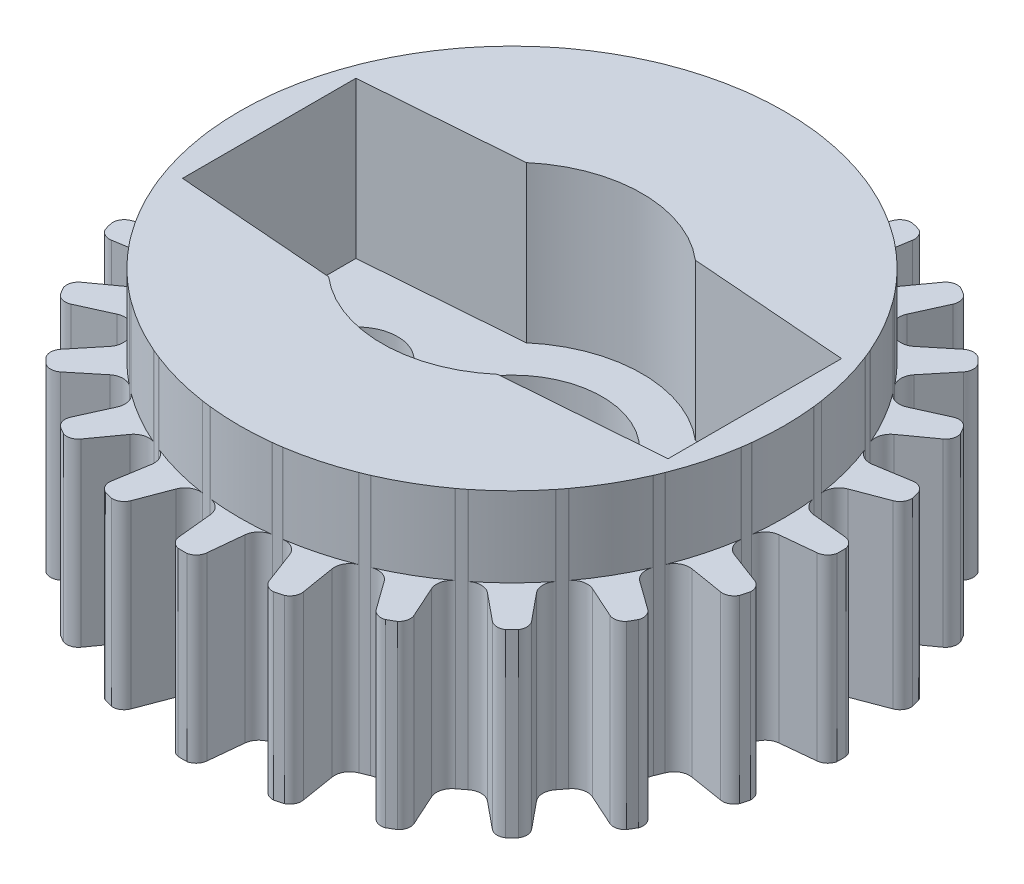
from build123d import *

# Parameters (mm, degrees)
SKETCH1_R           = 9.5
SKETCH1_R_2         = 2.6
BOSS_EXTRUDE1_DEPTH = 7.5
CUT_EXTRUDE1_START  = -7.5
SKETCH2_R           = 11.178148921
CUT_EXTRUDE1_DEPTH  = 7.5
BOSS_EXTRUDE2_START = -3.25
SKETCH3_R           = 2.6
SKETCH3_R_2         = 0.875
BOSS_EXTRUDE2_DEPTH = 3.25
CUT_EXTRUDE2_DEPTH  = 4.5
CUT_EXTRUDE3_REACH  = 16.169
SKETCH5_R           = 1.15
CUT_EXTRUDE4_START  = -2.3
SKETCH6_R           = 10.680264015
SKETCH6_R_2         = 7.851751397
CUT_EXTRUDE4_DEPTH  = 2.3


with BuildPart() as part:
    # Sketch1 → Boss-Extrude1 (new body)
    with BuildSketch(Plane(origin=(0, 0, 0), x_dir=(1, 0, 0), z_dir=(0, 1, 0))):
        with Locations(Location((0, 0, 0), (0, 0, 270))):
            Circle(SKETCH1_R)
        with Locations(Location((0, 0, 0), (0, 0, 270))):
            Circle(SKETCH1_R_2, mode=Mode.SUBTRACT)
    extrude(amount=BOSS_EXTRUDE1_DEPTH)

    # Sketch2 → Cut-Extrude1 (cut)
    with BuildSketch(Plane(origin=(0, 7.5, 0), x_dir=(1, 0, 0), z_dir=(0, 1, 0)).offset(CUT_EXTRUDE1_START)):
        Circle(SKETCH2_R)
        with BuildLine():
            Line((0.5, 8.2), (0.4, 9.2))
            ThreePointArc((0.4, 9.2), (0.265875857, 9.437834476), (0, 9.5))
            ThreePointArc((0, 9.5), (-0.265875857, 9.437834476), (-0.4, 9.2))
            Line((-0.4, 9.2), (-0.5, 8.2))
            ThreePointArc((-0.5, 8.2), (-0.628607324, 7.928607324), (-0.9, 7.8))
            ThreePointArc((-0.9, 7.8), (-1.024859212, 7.784578575), (-1.149455308, 7.767158586))
            ThreePointArc((-1.149455308, 7.767158586), (-1.444886527, 7.821142129), (-1.639353257, 8.050001298))
            Line((-1.639353257, 8.050001298), (-1.994764884, 8.99004522))
            ThreePointArc((-1.994764884, 8.99004522), (-2.18587495, 9.1850618), (-2.458780928, 9.17629535))
            ThreePointArc((-2.458780928, 9.17629535), (-2.699507664, 9.047434329), (-2.767505545, 8.782989984))
            Line((-2.767505545, 8.782989984), (-2.605279083, 7.791182253))
            ThreePointArc((-2.605279083, 7.791182253), (-2.659262626, 7.495751034), (-2.888121795, 7.301284304))
            ThreePointArc((-2.888121795, 7.301284304), (-3.004735175, 7.25407241), (-3.120577137, 7.20499815))
            ThreePointArc((-3.120577137, 7.20499815), (-3.41991375, 7.180679022), (-3.666987298, 7.351408311))
            Line((-3.666987298, 7.351408311), (-4.253589838, 8.167433715))
            ThreePointArc((-4.253589838, 8.167433715), (-4.488661992, 8.306342342), (-4.75, 8.227241336))
            ThreePointArc((-4.75, 8.227241336), (-4.949172485, 8.040466485), (-4.946410162, 7.767433715))
            Line((-4.946410162, 7.767433715), (-4.533012702, 6.851408311))
            ThreePointArc((-4.533012702, 6.851408311), (-4.508693574, 6.552071697), (-4.679422863, 6.30499815))
            ThreePointArc((-4.679422863, 6.30499815), (-4.779843401, 6.229213198), (-4.87903679, 6.151828996))
            ThreePointArc((-4.87903679, 6.151828996), (-5.161879503, 6.050864506), (-5.444722215, 6.151828996))
            Line((-5.444722215, 6.151828996), (-6.222539674, 6.788225099))
            ThreePointArc((-6.222539674, 6.788225099), (-6.485554136, 6.861559379), (-6.717514421, 6.717514421))
            ThreePointArc((-6.717514421, 6.717514421), (-6.861559379, 6.485554136), (-6.788225099, 6.222539674))
            Line((-6.788225099, 6.222539674), (-6.151828996, 5.444722215))
            ThreePointArc((-6.151828996, 5.444722215), (-6.050864506, 5.161879503), (-6.151828996, 4.87903679))
            ThreePointArc((-6.151828996, 4.87903679), (-6.229213198, 4.779843401), (-6.30499815, 4.679422863))
            ThreePointArc((-6.30499815, 4.679422863), (-6.552071697, 4.508693574), (-6.851408311, 4.533012702))
            Line((-6.851408311, 4.533012702), (-7.767433715, 4.946410162))
            ThreePointArc((-7.767433715, 4.946410162), (-8.040466485, 4.949172485), (-8.227241336, 4.75))
            ThreePointArc((-8.227241336, 4.75), (-8.306342342, 4.488661992), (-8.167433715, 4.253589838))
            Line((-8.167433715, 4.253589838), (-7.351408311, 3.666987298))
            ThreePointArc((-7.351408311, 3.666987298), (-7.180679022, 3.41991375), (-7.20499815, 3.120577137))
            ThreePointArc((-7.20499815, 3.120577137), (-7.25407241, 3.004735175), (-7.301284304, 2.888121795))
            ThreePointArc((-7.301284304, 2.888121795), (-7.495751034, 2.659262626), (-7.791182253, 2.605279083))
            Line((-7.791182253, 2.605279083), (-8.782989984, 2.767505545))
            ThreePointArc((-8.782989984, 2.767505545), (-9.047434329, 2.699507664), (-9.17629535, 2.458780928))
            ThreePointArc((-9.17629535, 2.458780928), (-9.1850618, 2.18587495), (-8.99004522, 1.994764884))
            Line((-8.99004522, 1.994764884), (-8.050001298, 1.639353257))
            ThreePointArc((-8.050001298, 1.639353257), (-7.821142129, 1.444886527), (-7.767158586, 1.149455308))
            ThreePointArc((-7.767158586, 1.149455308), (-7.784578575, 1.024859212), (-7.8, 0.9))
            ThreePointArc((-7.8, 0.9), (-7.928607324, 0.628607324), (-8.2, 0.5))
            Line((-8.2, 0.5), (-9.2, 0.4))
            ThreePointArc((-9.2, 0.4), (-9.437834476, 0.265875857), (-9.5, 0))
            ThreePointArc((-9.5, 0), (-9.437834476, -0.265875857), (-9.2, -0.4))
            Line((-9.2, -0.4), (-8.2, -0.5))
            ThreePointArc((-8.2, -0.5), (-7.928607324, -0.628607324), (-7.8, -0.9))
            ThreePointArc((-7.8, -0.9), (-7.784578575, -1.024859212), (-7.767158586, -1.149455308))
            ThreePointArc((-7.767158586, -1.149455308), (-7.821142129, -1.444886527), (-8.050001298, -1.639353257))
            Line((-8.050001298, -1.639353257), (-8.99004522, -1.994764884))
            ThreePointArc((-8.99004522, -1.994764884), (-9.1850618, -2.18587495), (-9.17629535, -2.458780928))
            ThreePointArc((-9.17629535, -2.458780928), (-9.047434329, -2.699507664), (-8.782989984, -2.767505545))
            Line((-8.782989984, -2.767505545), (-7.791182253, -2.605279083))
            ThreePointArc((-7.791182253, -2.605279083), (-7.495751034, -2.659262626), (-7.301284304, -2.888121795))
            ThreePointArc((-7.301284304, -2.888121795), (-7.25407241, -3.004735175), (-7.20499815, -3.120577137))
            ThreePointArc((-7.20499815, -3.120577137), (-7.180679022, -3.41991375), (-7.351408311, -3.666987298))
            Line((-7.351408311, -3.666987298), (-8.167433715, -4.253589838))
            ThreePointArc((-8.167433715, -4.253589838), (-8.306342342, -4.488661992), (-8.227241336, -4.75))
            ThreePointArc((-8.227241336, -4.75), (-8.040466485, -4.949172485), (-7.767433715, -4.946410162))
            Line((-7.767433715, -4.946410162), (-6.851408311, -4.533012702))
            ThreePointArc((-6.851408311, -4.533012702), (-6.552071697, -4.508693574), (-6.30499815, -4.679422863))
            ThreePointArc((-6.30499815, -4.679422863), (-6.229213198, -4.779843401), (-6.151828996, -4.87903679))
            ThreePointArc((-6.151828996, -4.87903679), (-6.050864506, -5.161879503), (-6.151828996, -5.444722215))
            Line((-6.151828996, -5.444722215), (-6.788225099, -6.222539674))
            ThreePointArc((-6.788225099, -6.222539674), (-6.861559379, -6.485554136), (-6.717514421, -6.717514421))
            ThreePointArc((-6.717514421, -6.717514421), (-6.485554136, -6.861559379), (-6.222539674, -6.788225099))
            Line((-6.222539674, -6.788225099), (-5.444722215, -6.151828996))
            ThreePointArc((-5.444722215, -6.151828996), (-5.161879503, -6.050864506), (-4.87903679, -6.151828996))
            ThreePointArc((-4.87903679, -6.151828996), (-4.779843401, -6.229213198), (-4.679422863, -6.30499815))
            ThreePointArc((-4.679422863, -6.30499815), (-4.508693574, -6.552071697), (-4.533012702, -6.851408311))
            Line((-4.533012702, -6.851408311), (-4.946410162, -7.767433715))
            ThreePointArc((-4.946410162, -7.767433715), (-4.949172485, -8.040466485), (-4.75, -8.227241336))
            ThreePointArc((-4.75, -8.227241336), (-4.488661992, -8.306342342), (-4.253589838, -8.167433715))
            Line((-4.253589838, -8.167433715), (-3.666987298, -7.351408311))
            ThreePointArc((-3.666987298, -7.351408311), (-3.41991375, -7.180679022), (-3.120577137, -7.20499815))
            ThreePointArc((-3.120577137, -7.20499815), (-3.004735175, -7.25407241), (-2.888121795, -7.301284304))
            ThreePointArc((-2.888121795, -7.301284304), (-2.659262626, -7.495751034), (-2.605279083, -7.791182253))
            Line((-2.605279083, -7.791182253), (-2.767505545, -8.782989984))
            ThreePointArc((-2.767505545, -8.782989984), (-2.699507664, -9.047434329), (-2.458780928, -9.17629535))
            ThreePointArc((-2.458780928, -9.17629535), (-2.18587495, -9.1850618), (-1.994764884, -8.99004522))
            Line((-1.994764884, -8.99004522), (-1.639353257, -8.050001298))
            ThreePointArc((-1.639353257, -8.050001298), (-1.444886527, -7.821142129), (-1.149455308, -7.767158586))
            ThreePointArc((-1.149455308, -7.767158586), (-1.024859212, -7.784578575), (-0.9, -7.8))
            ThreePointArc((-0.9, -7.8), (-0.628607324, -7.928607324), (-0.5, -8.2))
            Line((-0.5, -8.2), (-0.4, -9.2))
            ThreePointArc((-0.4, -9.2), (-0.265875857, -9.437834476), (0, -9.5))
            ThreePointArc((0, -9.5), (0.265875857, -9.437834476), (0.4, -9.2))
            Line((0.4, -9.2), (0.5, -8.2))
            ThreePointArc((0.5, -8.2), (0.628607324, -7.928607324), (0.9, -7.8))
            ThreePointArc((0.9, -7.8), (1.024859212, -7.784578575), (1.149455308, -7.767158586))
            ThreePointArc((1.149455308, -7.767158586), (1.444886527, -7.821142129), (1.639353257, -8.050001298))
            Line((1.639353257, -8.050001298), (1.994764884, -8.99004522))
            ThreePointArc((1.994764884, -8.99004522), (2.18587495, -9.1850618), (2.458780928, -9.17629535))
            ThreePointArc((2.458780928, -9.17629535), (2.699507664, -9.047434329), (2.767505545, -8.782989984))
            Line((2.767505545, -8.782989984), (2.605279083, -7.791182253))
            ThreePointArc((2.605279083, -7.791182253), (2.659262626, -7.495751034), (2.888121795, -7.301284304))
            ThreePointArc((2.888121795, -7.301284304), (3.004735175, -7.25407241), (3.120577137, -7.20499815))
            ThreePointArc((3.120577137, -7.20499815), (3.41991375, -7.180679022), (3.666987298, -7.351408311))
            Line((3.666987298, -7.351408311), (4.253589838, -8.167433715))
            ThreePointArc((4.253589838, -8.167433715), (4.488661992, -8.306342342), (4.75, -8.227241336))
            ThreePointArc((4.75, -8.227241336), (4.949172485, -8.040466485), (4.946410162, -7.767433715))
            Line((4.946410162, -7.767433715), (4.533012702, -6.851408311))
            ThreePointArc((4.533012702, -6.851408311), (4.508693574, -6.552071697), (4.679422863, -6.30499815))
            ThreePointArc((4.679422863, -6.30499815), (4.779843401, -6.229213198), (4.87903679, -6.151828996))
            ThreePointArc((4.87903679, -6.151828996), (5.161879503, -6.050864506), (5.444722215, -6.151828996))
            Line((5.444722215, -6.151828996), (6.222539674, -6.788225099))
            ThreePointArc((6.222539674, -6.788225099), (6.485554136, -6.861559379), (6.717514421, -6.717514421))
            ThreePointArc((6.717514421, -6.717514421), (6.861559379, -6.485554136), (6.788225099, -6.222539674))
            Line((6.788225099, -6.222539674), (6.151828996, -5.444722215))
            ThreePointArc((6.151828996, -5.444722215), (6.050864506, -5.161879503), (6.151828996, -4.87903679))
            ThreePointArc((6.151828996, -4.87903679), (6.229213198, -4.779843401), (6.30499815, -4.679422863))
            ThreePointArc((6.30499815, -4.679422863), (6.552071697, -4.508693574), (6.851408311, -4.533012702))
            Line((6.851408311, -4.533012702), (7.767433715, -4.946410162))
            ThreePointArc((7.767433715, -4.946410162), (8.040466485, -4.949172485), (8.227241336, -4.75))
            ThreePointArc((8.227241336, -4.75), (8.306342342, -4.488661992), (8.167433715, -4.253589838))
            Line((8.167433715, -4.253589838), (7.351408311, -3.666987298))
            ThreePointArc((7.351408311, -3.666987298), (7.180679022, -3.41991375), (7.20499815, -3.120577137))
            ThreePointArc((7.20499815, -3.120577137), (7.25407241, -3.004735175), (7.301284304, -2.888121795))
            ThreePointArc((7.301284304, -2.888121795), (7.495751034, -2.659262626), (7.791182253, -2.605279083))
            Line((7.791182253, -2.605279083), (8.782989984, -2.767505545))
            ThreePointArc((8.782989984, -2.767505545), (9.047434329, -2.699507664), (9.17629535, -2.458780928))
            ThreePointArc((9.17629535, -2.458780928), (9.1850618, -2.18587495), (8.99004522, -1.994764884))
            Line((8.99004522, -1.994764884), (8.050001298, -1.639353257))
            ThreePointArc((8.050001298, -1.639353257), (7.821142129, -1.444886527), (7.767158586, -1.149455308))
            ThreePointArc((7.767158586, -1.149455308), (7.784578575, -1.024859212), (7.8, -0.9))
            ThreePointArc((7.8, -0.9), (7.928607324, -0.628607324), (8.2, -0.5))
            Line((8.2, -0.5), (9.2, -0.4))
            ThreePointArc((9.2, -0.4), (9.437834476, -0.265875857), (9.5, 0))
            ThreePointArc((9.5, 0), (9.437834476, 0.265875857), (9.2, 0.4))
            Line((9.2, 0.4), (8.2, 0.5))
            ThreePointArc((8.2, 0.5), (7.928607324, 0.628607324), (7.8, 0.9))
            ThreePointArc((7.8, 0.9), (7.784578575, 1.024859212), (7.767158586, 1.149455308))
            ThreePointArc((7.767158586, 1.149455308), (7.821142129, 1.444886527), (8.050001298, 1.639353257))
            Line((8.050001298, 1.639353257), (8.99004522, 1.994764884))
            ThreePointArc((8.99004522, 1.994764884), (9.1850618, 2.18587495), (9.17629535, 2.458780928))
            ThreePointArc((9.17629535, 2.458780928), (9.047434329, 2.699507664), (8.782989984, 2.767505545))
            Line((8.782989984, 2.767505545), (7.791182253, 2.605279083))
            ThreePointArc((7.791182253, 2.605279083), (7.495751034, 2.659262626), (7.301284304, 2.888121795))
            ThreePointArc((7.301284304, 2.888121795), (7.25407241, 3.004735175), (7.20499815, 3.120577137))
            ThreePointArc((7.20499815, 3.120577137), (7.180679022, 3.41991375), (7.351408311, 3.666987298))
            Line((7.351408311, 3.666987298), (8.167433715, 4.253589838))
            ThreePointArc((8.167433715, 4.253589838), (8.306342342, 4.488661992), (8.227241336, 4.75))
            ThreePointArc((8.227241336, 4.75), (8.040466485, 4.949172485), (7.767433715, 4.946410162))
            Line((7.767433715, 4.946410162), (6.851408311, 4.533012702))
            ThreePointArc((6.851408311, 4.533012702), (6.552071697, 4.508693574), (6.30499815, 4.679422863))
            ThreePointArc((6.30499815, 4.679422863), (6.229213198, 4.779843401), (6.151828996, 4.87903679))
            ThreePointArc((6.151828996, 4.87903679), (6.050864506, 5.161879503), (6.151828996, 5.444722215))
            Line((6.151828996, 5.444722215), (6.788225099, 6.222539674))
            ThreePointArc((6.788225099, 6.222539674), (6.861559379, 6.485554136), (6.717514421, 6.717514421))
            ThreePointArc((6.717514421, 6.717514421), (6.485554136, 6.861559379), (6.222539674, 6.788225099))
            Line((6.222539674, 6.788225099), (5.444722215, 6.151828996))
            ThreePointArc((5.444722215, 6.151828996), (5.161879503, 6.050864506), (4.87903679, 6.151828996))
            ThreePointArc((4.87903679, 6.151828996), (4.779843401, 6.229213198), (4.679422863, 6.30499815))
            ThreePointArc((4.679422863, 6.30499815), (4.508693574, 6.552071697), (4.533012702, 6.851408311))
            Line((4.533012702, 6.851408311), (4.946410162, 7.767433715))
            ThreePointArc((4.946410162, 7.767433715), (4.949172485, 8.040466485), (4.75, 8.227241336))
            ThreePointArc((4.75, 8.227241336), (4.488661992, 8.306342342), (4.253589838, 8.167433715))
            Line((4.253589838, 8.167433715), (3.666987298, 7.351408311))
            ThreePointArc((3.666987298, 7.351408311), (3.41991375, 7.180679022), (3.120577137, 7.20499815))
            ThreePointArc((3.120577137, 7.20499815), (3.004735175, 7.25407241), (2.888121795, 7.301284304))
            ThreePointArc((2.888121795, 7.301284304), (2.659262626, 7.495751034), (2.605279083, 7.791182253))
            Line((2.605279083, 7.791182253), (2.767505545, 8.782989984))
            ThreePointArc((2.767505545, 8.782989984), (2.699507664, 9.047434329), (2.458780928, 9.17629535))
            ThreePointArc((2.458780928, 9.17629535), (2.18587495, 9.1850618), (1.994764884, 8.99004522))
            Line((1.994764884, 8.99004522), (1.639353257, 8.050001298))
            ThreePointArc((1.639353257, 8.050001298), (1.444886527, 7.821142129), (1.149455308, 7.767158586))
            ThreePointArc((1.149455308, 7.767158586), (1.024859212, 7.784578575), (0.9, 7.8))
            ThreePointArc((0.9, 7.8), (0.628607324, 7.928607324), (0.5, 8.2))
        make_face(mode=Mode.SUBTRACT)
    extrude(amount=CUT_EXTRUDE1_DEPTH, mode=Mode.SUBTRACT)

    # Sketch3 → Boss-Extrude2 (add)
    with BuildSketch(Plane(origin=(0, 7.5, 0), x_dir=(1, 0, 0), z_dir=(0, 1, 0)).offset(BOSS_EXTRUDE2_START)):
        with Locations(Location((0, 0, 0), (0, 0, 270))):
            Circle(SKETCH3_R)
        with Locations(Location((0, 0, 0), (0, 0, 270))):
            Circle(SKETCH3_R_2, mode=Mode.SUBTRACT)
    extrude(amount=BOSS_EXTRUDE2_DEPTH)

    # Sketch4 → Cut-Extrude2 (cut)
    with BuildSketch(Plane(origin=(0, 7.5, 0), x_dir=(1, 0, 0), z_dir=(0, 1, 0))):
        with BuildLine():
            Line((-7, 2.5), (-2.437211521, 2.85))
            ThreePointArc((-2.437211521, 2.85), (0, 3.75), (2.437211521, 2.85))
            Line((2.437211521, 2.85), (7, 2.5))
            Line((7, 2.5), (7, -2.5))
            Line((7, -2.5), (2.437211521, -2.85))
            ThreePointArc((2.437211521, -2.85), (0, -3.75), (-2.437211521, -2.85))
            Line((-2.437211521, -2.85), (-7, -2.5))
            Line((-7, -2.5), (-7, 2.5))
        make_face()
    extrude(amount=-CUT_EXTRUDE2_DEPTH, mode=Mode.SUBTRACT)

    # Sketch5 → Cut-Extrude3 (cut, up to next)
    with BuildSketch(Plane(origin=(0, 3, 0), x_dir=(1, 0, 0), z_dir=(0, 1, 0)), mode=Mode.PRIVATE) as cut_extrude3_sk1:
        with Locations(Location((-4.45, 0, 0), (0, 0, 270))):
            Circle(SKETCH5_R)
    cut_extrude3_tool1 = extrude(cut_extrude3_sk1.sketch, amount=-CUT_EXTRUDE3_REACH, mode=Mode.PRIVATE) & part.part
    # Sketch5 → Cut-Extrude3 (cut, up to next)
    with BuildSketch(Plane(origin=(0, 3, 0), x_dir=(1, 0, 0), z_dir=(0, 1, 0)), mode=Mode.PRIVATE) as cut_extrude3_sk2:
        with Locations(Location((4.45, 0, 0), (0, 0, 270))):
            Circle(SKETCH5_R)
    cut_extrude3_tool2 = extrude(cut_extrude3_sk2.sketch, amount=-CUT_EXTRUDE3_REACH, mode=Mode.PRIVATE) & part.part
    add(cut_extrude3_tool1.solids().sort_by_distance((-4.45, 3, 0))[0], mode=Mode.SUBTRACT)
    add(cut_extrude3_tool2.solids().sort_by_distance((4.45, 3, 0))[0], mode=Mode.SUBTRACT)

    # Sketch6 → Cut-Extrude4 (cut)
    with BuildSketch(Plane(origin=(0, 7.5, 0), x_dir=(1, 0, 0), z_dir=(0, 1, 0)).offset(CUT_EXTRUDE4_START)):
        Circle(SKETCH6_R)
        Circle(SKETCH6_R_2, mode=Mode.SUBTRACT)
    extrude(amount=CUT_EXTRUDE4_DEPTH, mode=Mode.SUBTRACT)


solid = part.part
